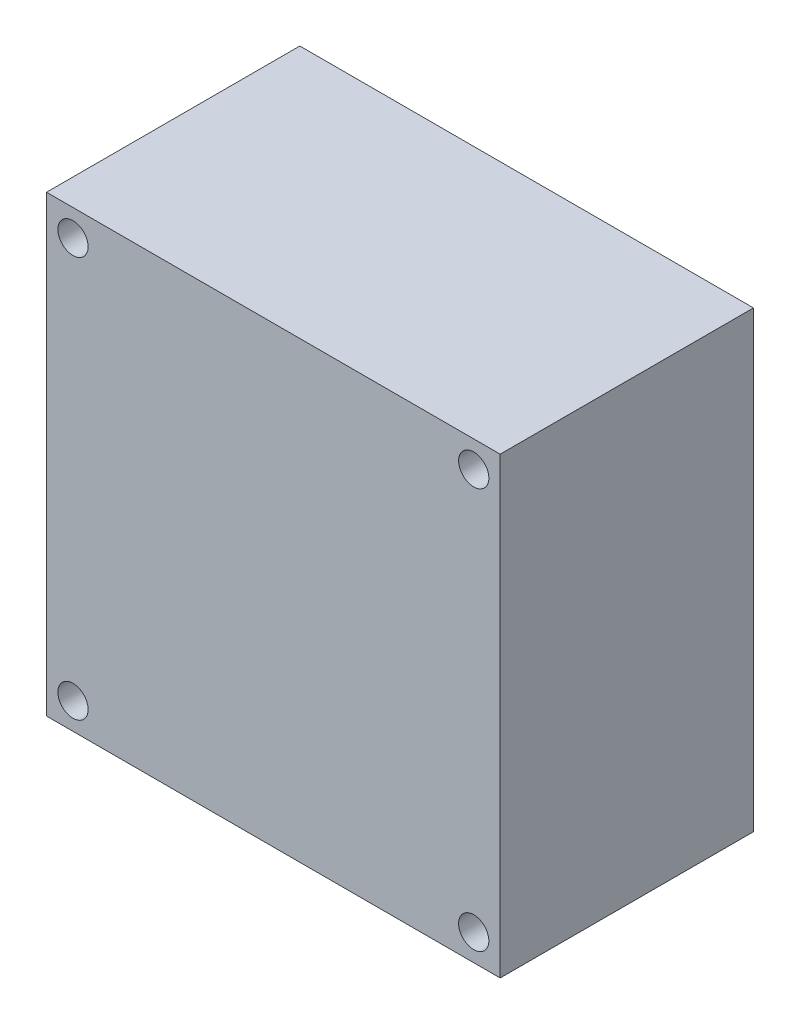
from build123d import *

# Parameters (mm, degrees)
SZKIC1_W                    = 120
SZKIC1_H                    = 120
DODANIE_WYCI_GNI_CIE1_DEPTH = 67
SZKIC5_R                    = 4
WYTNIJ_WYCI_GNI_CIE1_DEPTH  = 25


with BuildPart() as part:
    # Szkic1 → Dodanie-wyciągnięcie1 (new body)
    with BuildSketch(Plane.XY):
        with Locations((60, 60)):
            Rectangle(SZKIC1_W, SZKIC1_H)
    extrude(amount=DODANIE_WYCI_GNI_CIE1_DEPTH)

    # Szkic5 → Wytnij-wyciągnięcie1 (cut)
    with BuildSketch(Plane.XY.offset(67)):
        with Locations((7, 113)):
            Circle(SZKIC5_R)
        with Locations((7, 7)):
            Circle(SZKIC5_R)
        with Locations(Location((113, 113, 0), (0, 0, 180))):
            Circle(SZKIC5_R)
        with Locations(Location((113, 7, 0), (0, 0, 180))):
            Circle(SZKIC5_R)
    extrude(amount=-WYTNIJ_WYCI_GNI_CIE1_DEPTH, mode=Mode.SUBTRACT)


solid = part.part
